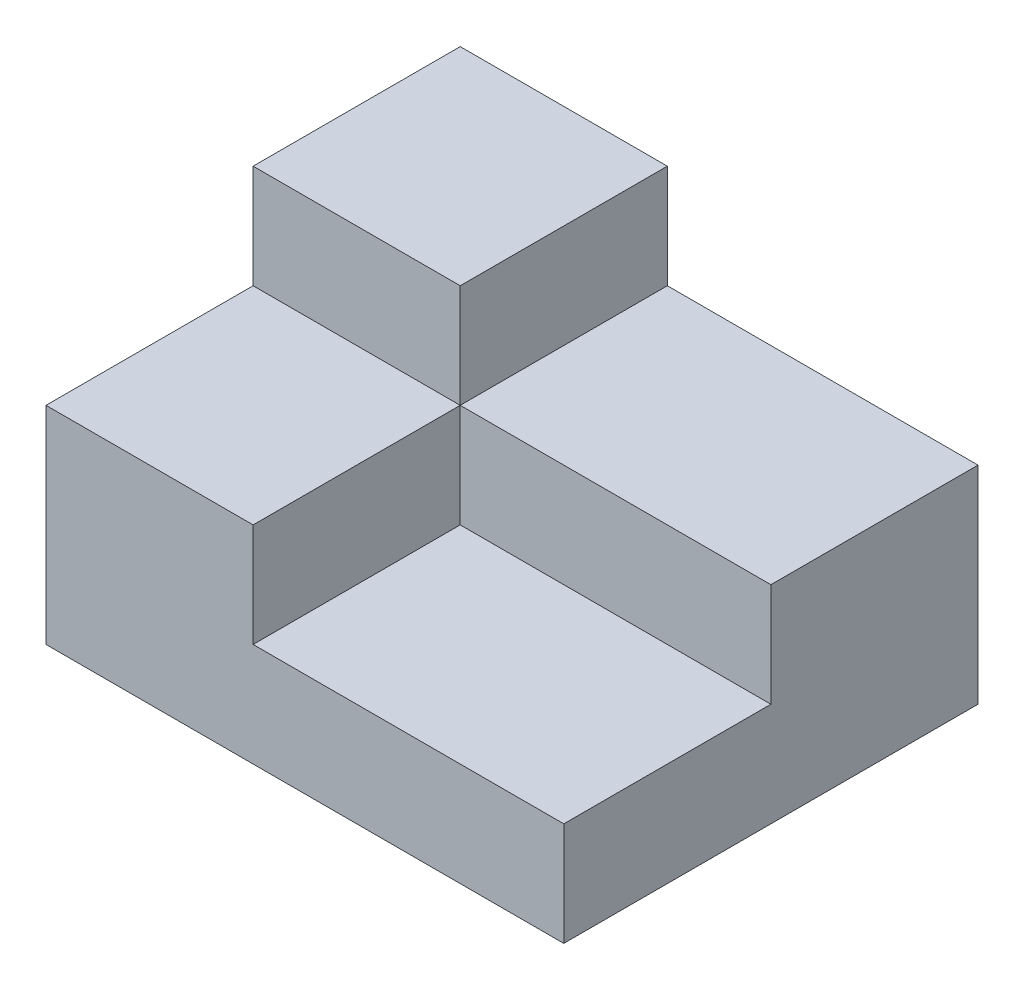
from build123d import *

# Parameters (mm, degrees)
SKETCH1_W           = 127
SKETCH1_H           = 101.6
BOSS_EXTRUDE1_DEPTH = 25.4
BOSS_EXTRUDE2_DEPTH = 25.4
SKETCH3_W           = 50.8
SKETCH3_H           = 50.8
BOSS_EXTRUDE3_DEPTH = 25.4


with BuildPart() as part:
    # Sketch1 → Boss-Extrude1 (new body)
    with BuildSketch(Plane(origin=(0, 0, 0), x_dir=(1, 0, 0), z_dir=(0, 1, 0))):
        Rectangle(SKETCH1_W, SKETCH1_H)
    extrude(amount=BOSS_EXTRUDE1_DEPTH)

    # Sketch2 → Boss-Extrude2 (add)
    with BuildSketch(Plane(origin=(0, 25.4, 0), x_dir=(1, 0, 0), z_dir=(0, 1, 0))):
        Polygon((-63.5, 50.8), (-35.60262538, 50.8), (63.5, 50.8), (63.5, 0), (-12.7, 0), (-12.7, -50.8), (-63.5, -50.8), align=None)
    extrude(amount=BOSS_EXTRUDE2_DEPTH)

    # Sketch3 → Boss-Extrude3 (add)
    with BuildSketch(Plane(origin=(0, 50.8, 0), x_dir=(1, 0, 0), z_dir=(0, 1, 0))):
        with Locations((-38.1, 25.4)):
            Rectangle(SKETCH3_W, SKETCH3_H)
    extrude(amount=BOSS_EXTRUDE3_DEPTH)


solid = part.part
